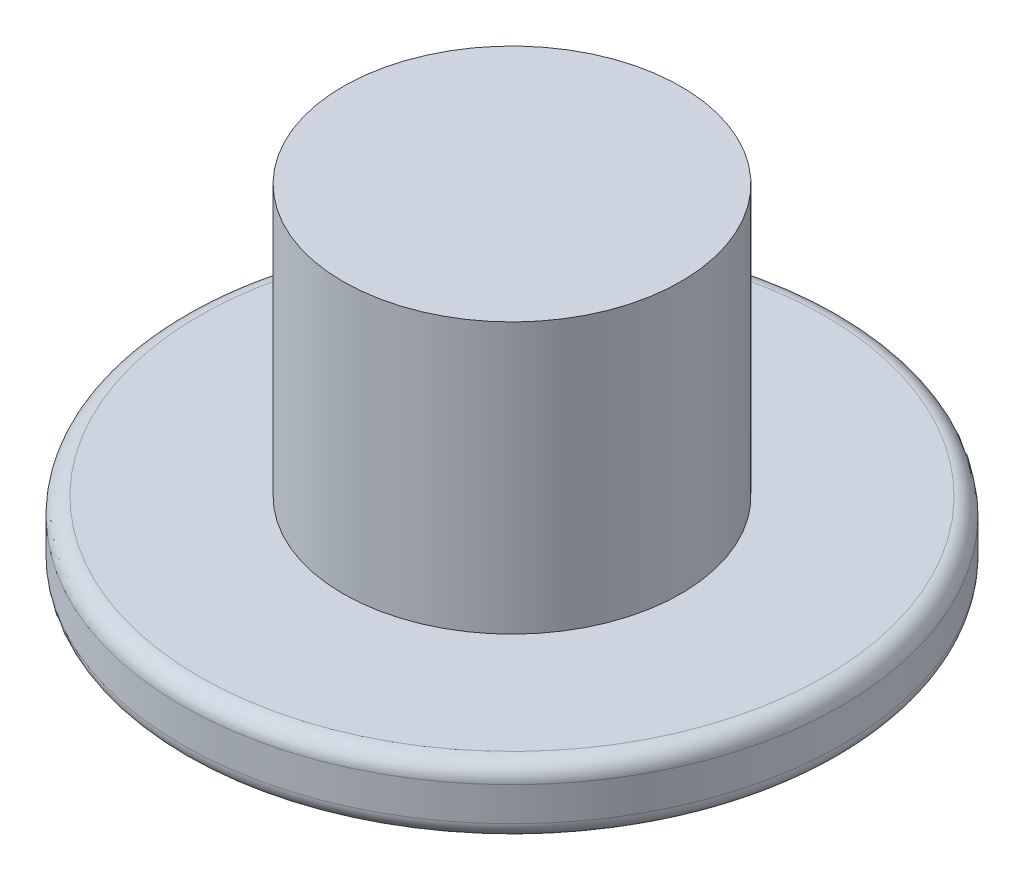
from build123d import *

# Parameters (mm, degrees)
SKETCH1_R           = 9.75
BOSS_EXTRUDE5_DEPTH = 2
SKETCH4_R           = 5
BOSS_EXTRUDE6_DEPTH = 8
CUT_EXTRUDE2_DEPTH  = 0.5
FILLET1_R           = 0.5


with BuildPart() as part:
    # Sketch1 → Boss-Extrude5 (new body)
    with BuildSketch(Plane(origin=(0, 0, 0), x_dir=(1, 0, 0), z_dir=(0, 1, 0))):
        with Locations(Location((-5.408676197, -40.3067379, 0), (0, 0, 270))):
            Circle(SKETCH1_R)
    extrude(amount=BOSS_EXTRUDE5_DEPTH)

    # Sketch4 → Boss-Extrude6 (add)
    with BuildSketch(Plane(origin=(0, 2, 0), x_dir=(1, 0, 0), z_dir=(0, 1, 0))):
        with Locations(Location((-5.408676197, -40.3067379, 0), (0, 0, 270))):
            Circle(SKETCH4_R)
    extrude(amount=BOSS_EXTRUDE6_DEPTH)

    # Sketch5 → Cut-Extrude2 (cut)
    with BuildSketch(Plane.XZ):
        with BuildLine():
            Line((-6.676445146, 41.579675489), (-7.817671107, 41.579675489))
            add(Edge.make_bspline(
                [(-7.817671107, 41.579675489), (-7.812310426, 41.695801368), (-7.801825667, 41.922927653), (-7.755267935, 42.253876027), (-7.679847726, 42.565713816), (-7.584651501, 42.861084573), (-7.45766239, 43.136296006), (-7.311142358, 43.396145756), (-7.134259014, 43.635187883), (-6.934371171, 43.853800531), (-6.717385859, 44.05241863), (-6.484125633, 44.223683245), (-6.238533308, 44.369625985), (-5.980560591, 44.488716228), (-5.70970227, 44.580925529), (-5.426730394, 44.648023926), (-5.13074225, 44.688382018), (-4.928974632, 44.692813499), (-4.826685531, 44.695060105)],
                knots=[0, 0, 0, 0, 1.154964179, 2.258951466, 3.315045469, 4.34063582, 5.337653555, 6.322213479, 7.300594401, 8.285733883, 9.262436119, 10.219305053, 11.156568068, 12.097250375, 13.037875795, 13.995471444, 14.983774372, 16, 16, 16, 16], degree=3))
            add(Edge.make_bspline(
                [(-4.826685531, 44.695060105), (-4.719588621, 44.692869366), (-4.50943487, 44.68857053), (-4.203400393, 44.648117964), (-3.913766774, 44.58288823), (-3.640449207, 44.493807864), (-3.383945659, 44.374862374), (-3.14375032, 44.231427232), (-2.922172064, 44.05902337), (-2.717602692, 43.866114214), (-2.536915038, 43.653912553), (-2.373716977, 43.435744039), (-2.238817979, 43.207183965), (-2.125806623, 42.972405889), (-2.038842603, 42.729482892), (-1.977428884, 42.479403561), (-1.940616475, 42.221997964), (-1.935591973, 42.047942984), (-1.933055723, 41.960084143)],
                knots=[0, 0, 0, 0, 1.156722346, 2.269809107, 3.328396062, 4.361258308, 5.3694338, 6.377253737, 7.377324894, 8.397019439, 9.4098266, 10.385180797, 11.337325354, 12.27255833, 13.196816462, 14.119704983, 15.050871513, 16, 16, 16, 16], degree=3))
            add(Edge.make_bspline(
                [(-1.933055723, 41.960084143), (-1.937670931, 41.837184043), (-1.946838122, 41.593067475), (-2.017428332, 41.231911022), (-2.136098747, 40.882386988), (-2.273174428, 40.597782754), (-2.411809943, 40.367733096), (-2.539034806, 40.177847763), (-2.688491104, 39.972524075), (-2.863384002, 39.753136485), (-3.056759049, 39.514665319), (-3.276297862, 39.263262394), (-3.515205381, 38.99383788), (-3.685590507, 38.812419869), (-3.773800915, 38.718497605)],
                knots=[0, 0, 0, 0, 1.155755081, 2.295677249, 3.447123235, 4.6205014, 5.259503175, 5.973005395, 6.77029923, 7.648035671, 8.612336498, 9.658570495, 10.787814065, 12, 12, 12, 12], degree=3))
            Line((-3.773800915, 38.718497605), (-5.987743223, 36.502752412))
            Line((-5.987743223, 36.502752412), (-1.817671107, 36.502752412))
            Line((-1.817671107, 36.502752412), (-1.817671107, 35.464290874))
            Line((-1.817671107, 35.464290874), (-8.163824954, 35.464290874))
            Line((-8.163824954, 35.464290874), (-4.720315338, 39.266574528))
            add(Edge.make_bspline(
                [(-4.720315338, 39.266574528), (-4.638295504, 39.354047762), (-4.480897943, 39.521910498), (-4.259068364, 39.767634589), (-4.058928423, 39.994802676), (-3.879411097, 40.203250768), (-3.725217211, 40.395780628), (-3.592198644, 40.569559806), (-3.48186119, 40.72540892), (-3.367275219, 40.908856301), (-3.253732275, 41.128759827), (-3.157143346, 41.39701125), (-3.099185258, 41.670954142), (-3.090998341, 41.855248913), (-3.086901877, 41.947463951)],
                knots=[0, 0, 0, 0, 1.341560447, 2.574479018, 3.703506985, 4.728875774, 5.651874962, 6.462761537, 7.177175968, 7.787249671, 8.88179658, 9.938774664, 10.968630673, 12, 12, 12, 12], degree=3))
            add(Edge.make_bspline(
                [(-3.086901877, 41.947463951), (-3.087911417, 42.004670669), (-3.089908998, 42.117865747), (-3.117142724, 42.283626365), (-3.155506319, 42.444404941), (-3.214841381, 42.597616639), (-3.286329214, 42.746275734), (-3.375747774, 42.888460482), (-3.483123565, 43.022851966), (-3.602569027, 43.15247391), (-3.734678848, 43.269507844), (-3.874218391, 43.374470164), (-4.022903654, 43.459713223), (-4.176669359, 43.53425977), (-4.340295405, 43.587108395), (-4.509759668, 43.626456912), (-4.686392781, 43.653714425), (-4.806748776, 43.655624226), (-4.868151877, 43.656598566)],
                knots=[0, 0, 0, 0, 0.999432927, 1.977580462, 2.931018689, 3.885672852, 4.844657058, 5.812871023, 6.815890212, 7.849665183, 8.891901864, 9.898878619, 10.897592748, 11.885014695, 12.882178885, 13.896915602, 14.927050508, 16, 16, 16, 16], degree=3))
            add(Edge.make_bspline(
                [(-4.868151877, 43.656598566), (-4.926527495, 43.655401271), (-5.041367662, 43.653045877), (-5.210498233, 43.628743667), (-5.372842642, 43.58917489), (-5.528948546, 43.534289387), (-5.679946595, 43.466576563), (-5.822144632, 43.378854732), (-5.957866841, 43.276807213), (-6.088907502, 43.162274235), (-6.208169616, 43.027904249), (-6.314840719, 42.87528957), (-6.409035513, 42.704263904), (-6.489548923, 42.51512644), (-6.55627432, 42.307380975), (-6.609801194, 42.081280118), (-6.651182642, 41.836725471), (-6.667868533, 41.66694389), (-6.676445146, 41.579675489)],
                knots=[0, 0, 0, 0, 0.911540883, 1.79324023, 2.663162255, 3.518366492, 4.375475705, 5.243419306, 6.122264358, 7.02676621, 7.957780629, 8.921596253, 9.930241338, 11.002848587, 12.128200329, 13.335197372, 14.630280975, 16, 16, 16, 16], degree=3))
        make_face()
    extrude(amount=-CUT_EXTRUDE2_DEPTH, mode=Mode.SUBTRACT)

    # Fillet1
    fillet1_edges = [part.edges().sort_by_distance(p)[0] for p in [
        (-5.408676197, 0, 30.5567379),
        (-5.408676197, 2, 30.5567379),
    ]]
    fillet(fillet1_edges, radius=FILLET1_R)


solid = part.part
